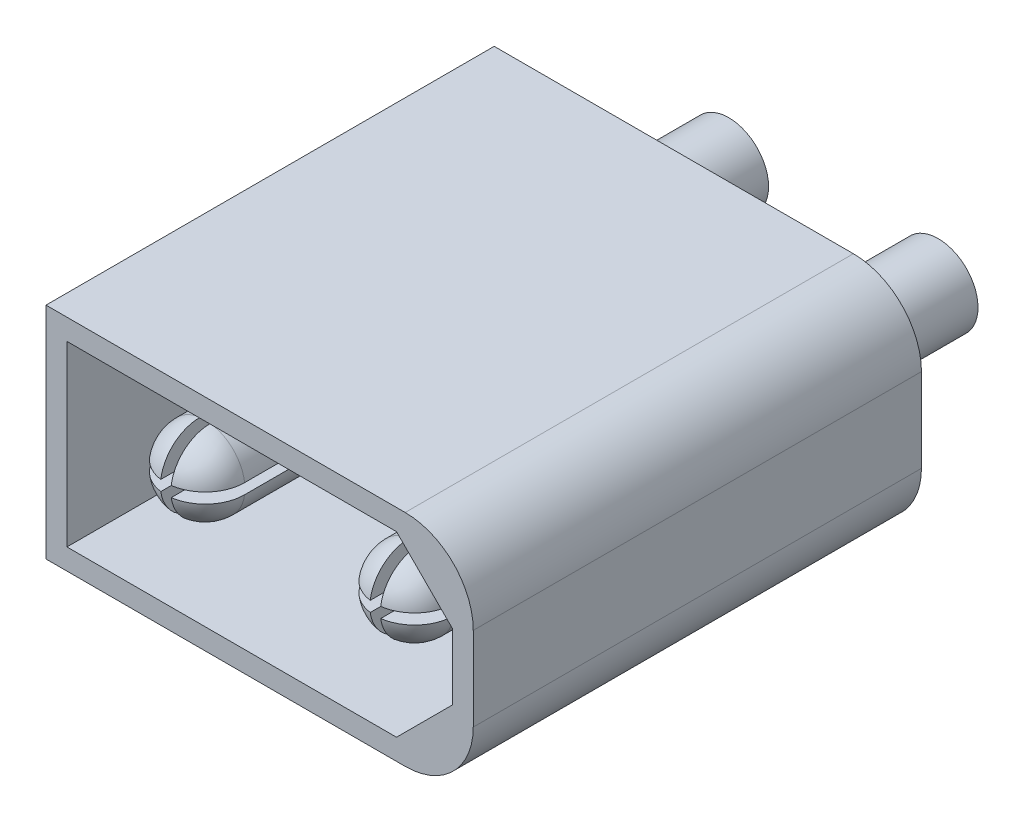
from build123d import *

# Parameters (mm, degrees)
BOSS_EXTRUDE1_DEPTH        = 10.7
BOSS_EXTRUDE5_DEPTH        = 9.5
BOSS_EXTRUDE5_DEPTH_BACK   = 3
SKETCH1_4_R                = 0.95
BOSS_EXTRUDE5_2_DEPTH      = 9.5
BOSS_EXTRUDE5_2_DEPTH_BACK = 3
BOSS_EXTRUDE3_DEPTH        = 2.5
DOME1_FACE_RADIUS          = 0.95
DOME1_HEIGHT               = 0.95
DOME2_FACE_RADIUS          = 0.95
DOME2_HEIGHT               = 0.95
CUT_EXTRUDE1_DEPTH         = 14.85390288


with BuildPart() as part:
    # Sketch1 → Boss-Extrude1 (new body)
    with BuildSketch(Plane.XY):
        with BuildLine():
            Line((0, -2.625), (0, 2.625))
            Line((0, 2.625), (8.575, 2.625))
            ThreePointArc((8.575, 2.625), (9.724048519, 2.149048519), (10.2, 1))
            Line((10.2, 1), (10.2, -1))
            ThreePointArc((10.2, -1), (9.724048519, -2.149048519), (8.575, -2.625))
            Line((8.575, -2.625), (0, -2.625))
        make_face()
        Polygon((0.5, -2.125), (8.367893219, -2.125), (9.7, -0.792893219), (9.7, 0.792893219), (8.367893219, 2.125), (0.5, 2.125), align=None, mode=Mode.SUBTRACT)
    extrude(amount=BOSS_EXTRUDE1_DEPTH)

    # Sketch3 → Boss-Extrude3 (add)
    with BuildSketch(Plane(origin=(0, 0, 1), x_dir=(-1, 0, 0), z_dir=(0, 0, -1))):
        Polygon((-0.5, -2.125), (-0.5, 2.125), (-8.367893219, 2.125), (-9.7, 0.792893219), (-9.7, -0.792893219), (-8.367893219, -2.125), align=None)
    extrude(amount=-BOSS_EXTRUDE3_DEPTH)


with BuildPart() as body_2:
    # Sketch1<4> → Boss-Extrude5 (new, two sides: drawn at the far end of the back side and taken through both)
    with BuildSketch(Plane.XY.offset(-BOSS_EXTRUDE5_DEPTH_BACK)):
        with Locations((2.6, 0)):
            Circle(SKETCH1_4_R)
    extrude(amount=BOSS_EXTRUDE5_DEPTH + BOSS_EXTRUDE5_DEPTH_BACK)

    # Dome2: a dome of height H over a round flat face of radius A is a cap of a sphere of radius (A * A + H * H) / (2 * H)
    dome2_r = (DOME2_FACE_RADIUS * DOME2_FACE_RADIUS + DOME2_HEIGHT * DOME2_HEIGHT) / (2 * DOME2_HEIGHT)
    dome2_base = Plane((2.6, 0, 9.5), z_dir=(0, 0, 1))
    with Locations(dome2_base.offset(DOME2_HEIGHT - dome2_r)):
        dome2_ball = Sphere(dome2_r, mode=Mode.PRIVATE)
    add(split(dome2_ball, bisect_by=dome2_base, keep=Keep.TOP, mode=Mode.PRIVATE))


with BuildPart() as body_3:
    # Sketch1<4> → Boss-Extrude5 2 (new, two sides: drawn at the far end of the back side and taken through both)
    with BuildSketch(Plane.XY.offset(-BOSS_EXTRUDE5_2_DEPTH_BACK)):
        with Locations(Location((7.6, 0, 0), (0, 0, 180))):
            Circle(SKETCH1_4_R)
    extrude(amount=BOSS_EXTRUDE5_2_DEPTH + BOSS_EXTRUDE5_2_DEPTH_BACK)

    # Dome1: a dome of height H over a round flat face of radius A is a cap of a sphere of radius (A * A + H * H) / (2 * H)
    dome1_r = (DOME1_FACE_RADIUS * DOME1_FACE_RADIUS + DOME1_HEIGHT * DOME1_HEIGHT) / (2 * DOME1_HEIGHT)
    dome1_base = Plane((7.6, 0, 9.5), z_dir=(0, 0, 1))
    with Locations(dome1_base.offset(DOME1_HEIGHT - dome1_r)):
        dome1_ball = Sphere(dome1_r, mode=Mode.PRIVATE)
    add(split(dome1_ball, bisect_by=dome1_base, keep=Keep.TOP, mode=Mode.PRIVATE))


with BuildPart() as cut_extrude1_tool:
    # Sketch4 → Cut-Extrude1 (new, through all)
    with BuildSketch(Plane.XY.offset(6)):
        with BuildLine():
            Line((7.475, 0.94174041), (7.475, 0.125))
            Line((7.475, 0.125), (6.65825959, 0.125))
            ThreePointArc((6.65825959, 0.125), (6.65, 0), (6.65825959, -0.125))
            Line((6.65825959, -0.125), (7.475, -0.125))
            Line((7.475, -0.125), (7.475, -0.94174041))
            ThreePointArc((7.475, -0.94174041), (7.6, -0.95), (7.725, -0.94174041))
            Line((7.725, -0.94174041), (7.725, -0.125))
            Line((7.725, -0.125), (8.54174041, -0.125))
            ThreePointArc((8.54174041, -0.125), (8.55, 0), (8.54174041, 0.125))
            Line((8.54174041, 0.125), (7.725, 0.125))
            Line((7.725, 0.125), (7.725, 0.94174041))
            ThreePointArc((7.725, 0.94174041), (7.6, 0.95), (7.475, 0.94174041))
        make_face()
        with BuildLine():
            Line((3.54174041, -0.125), (2.725, -0.125))
            Line((2.725, -0.125), (2.725, -0.94174041))
            ThreePointArc((2.725, -0.94174041), (2.6, -0.95), (2.475, -0.94174041))
            Line((2.475, -0.94174041), (2.475, -0.125))
            Line((2.475, -0.125), (1.65825959, -0.125))
            ThreePointArc((1.65825959, -0.125), (1.65, 0), (1.65825959, 0.125))
            Line((1.65825959, 0.125), (2.475, 0.125))
            Line((2.475, 0.125), (2.475, 0.94174041))
            ThreePointArc((2.475, 0.94174041), (2.6, 0.95), (2.725, 0.94174041))
            Line((2.725, 0.94174041), (2.725, 0.125))
            Line((2.725, 0.125), (3.54174041, 0.125))
            ThreePointArc((3.54174041, 0.125), (3.55, 0), (3.54174041, -0.125))
        make_face()
    extrude(amount=CUT_EXTRUDE1_DEPTH)


with BuildPart() as body_2_1:
    add(body_2.part)

    # Cut-Extrude1: cut by cut_extrude1_tool
    add(cut_extrude1_tool.part, mode=Mode.SUBTRACT)


with BuildPart() as body_3_1:
    add(body_3.part)

    # Cut-Extrude1: cut by cut_extrude1_tool
    add(cut_extrude1_tool.part, mode=Mode.SUBTRACT)


solid = Compound([part.part, body_2_1.part, body_3_1.part])
